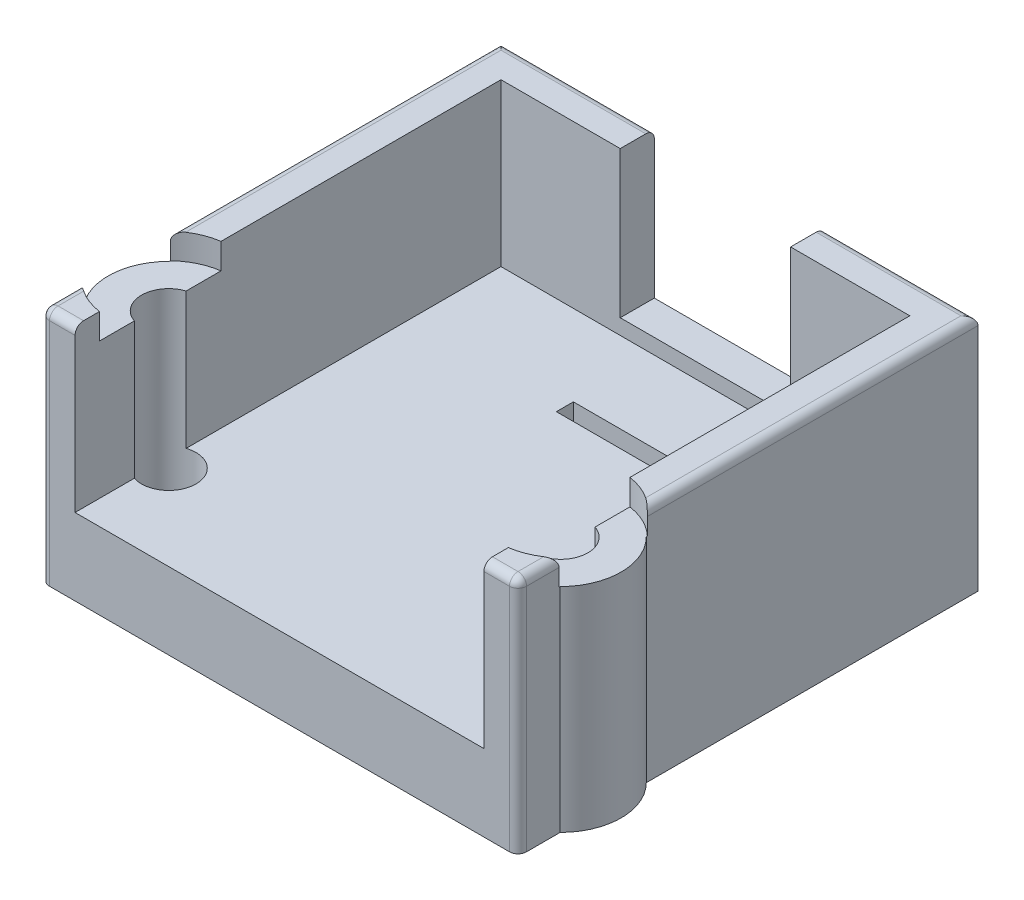
from build123d import *

# Parameters (mm, degrees)
SKETCH1_W           = 28
SKETCH1_H           = 27
BOSS_EXTRUDE1_DEPTH = 14
SHELL1_T            = -2
SKETCH2_W           = 24
SKETCH2_H           = 23
SKETCH2_W_2         = 6
SKETCH2_H_2         = 1
BOSS_EXTRUDE2_DEPTH = 2.5
CUT_EXTRUDE1_REACH  = 35.481
SKETCH3_W           = 24
SKETCH3_H           = 9.5
CUT_EXTRUDE2_REACH  = 25.964
SKETCH4_R           = 1.6
BOSS_EXTRUDE3_DEPTH = 14
CUT_EXTRUDE4_REACH  = 34.368
SKETCH7_W           = 10
SKETCH7_H           = 8.6
SKETCH8_R           = 3.6
CUT_EXTRUDE5_DEPTH  = 1.5
FILLET1_R           = 0.5


with BuildPart() as part:
    # Sketch1 → Boss-Extrude1 (new body)
    with BuildSketch(Plane(origin=(0, 0, 0), x_dir=(1, 0, 0), z_dir=(0, 1, 0))):
        Rectangle(SKETCH1_W, SKETCH1_H)
    extrude(amount=BOSS_EXTRUDE1_DEPTH)

    # Shell1
    shell1_openings = [part.faces().sort_by_distance(p)[0] for p in [
        (0, 14, 0),
    ]]
    offset(amount=SHELL1_T, openings=shell1_openings, kind=Kind.INTERSECTION)

    # Sketch2 → Boss-Extrude2 (add)
    with BuildSketch(Plane(origin=(0, 2, 0), x_dir=(1, 0, 0), z_dir=(0, 1, 0))):
        Rectangle(SKETCH2_W, SKETCH2_H)
        with Locations((0, 6.25)):
            Rectangle(SKETCH2_W_2, SKETCH2_H_2, mode=Mode.SUBTRACT)
    extrude(amount=BOSS_EXTRUDE2_DEPTH)

    # Sketch3 → Cut-Extrude1 (cut, up to next)
    with BuildSketch(Plane.XY.offset(13.5), mode=Mode.PRIVATE) as cut_extrude1_sk1:
        with Locations((0, 9.25)):
            Rectangle(SKETCH3_W, SKETCH3_H)
    cut_extrude1_tool1 = extrude(cut_extrude1_sk1.sketch, amount=-CUT_EXTRUDE1_REACH, mode=Mode.PRIVATE) & part.part
    add(cut_extrude1_tool1.solids().sort_by_distance((0, 9.25, 13.5))[0], mode=Mode.SUBTRACT)

    # Sketch4 → Cut-Extrude2 (cut, up to next)
    with BuildSketch(Plane(origin=(0, 14, 0), x_dir=(1, 0, 0), z_dir=(0, 1, 0)), mode=Mode.PRIVATE) as cut_extrude2_sk1:
        with Locations(Location((-11.5, -8.5, 0), (0, 0, 251.790043136))):
            Circle(SKETCH4_R)
    cut_extrude2_tool1 = extrude(cut_extrude2_sk1.sketch, amount=-CUT_EXTRUDE2_REACH, mode=Mode.PRIVATE) & part.part
    # Sketch4 → Cut-Extrude2 (cut, up to next)
    with BuildSketch(Plane(origin=(0, 14, 0), x_dir=(1, 0, 0), z_dir=(0, 1, 0)), mode=Mode.PRIVATE) as cut_extrude2_sk2:
        with Locations(Location((11.5, -8.5, 0), (0, 0, 288.209956864))):
            Circle(SKETCH4_R)
    cut_extrude2_tool2 = extrude(cut_extrude2_sk2.sketch, amount=-CUT_EXTRUDE2_REACH, mode=Mode.PRIVATE) & part.part
    add(cut_extrude2_tool1.solids().sort_by_distance((-11.5, 14, 8.5))[0], mode=Mode.SUBTRACT)
    add(cut_extrude2_tool2.solids().sort_by_distance((11.5, 14, 8.5))[0], mode=Mode.SUBTRACT)

    # Sketch5 → Boss-Extrude3 (add)
    with BuildSketch(Plane(origin=(0, 14, 0), x_dir=(1, 0, 0), z_dir=(0, 1, 0))):
        with BuildLine():
            Line((12, -4.980131585), (12, -6.980131585))
            ThreePointArc((12, -6.980131585), (13.1, -8.5), (12, -10.019868415))
            Line((12, -10.019868415), (12, -12.019868415))
            ThreePointArc((12, -12.019868415), (15.055203744, -8.5), (12, -4.980131585))
        make_face()
        with BuildLine():
            Line((-12, -4.980131585), (-12, -6.980131585))
            ThreePointArc((-12, -6.980131585), (-13.1, -8.5), (-12, -10.019868415))
            Line((-12, -10.019868415), (-12, -12.019868415))
            ThreePointArc((-12, -12.019868415), (-15.055203744, -8.5), (-12, -4.980131585))
        make_face()
    extrude(amount=-BOSS_EXTRUDE3_DEPTH)

    # Sketch7 → Cut-Extrude4 (cut, up to next)
    with BuildSketch(Plane.XY.offset(-11.5), mode=Mode.PRIVATE) as cut_extrude4_sk1:
        with Locations((0, 9.7)):
            Rectangle(SKETCH7_W, SKETCH7_H)
    cut_extrude4_tool1 = extrude(cut_extrude4_sk1.sketch, amount=-CUT_EXTRUDE4_REACH, mode=Mode.PRIVATE) & part.part
    add(cut_extrude4_tool1.solids().sort_by_distance((0, 9.7, -11.5))[0], mode=Mode.SUBTRACT)

    # Sketch8 → Cut-Extrude5 (cut)
    with BuildSketch(Plane(origin=(0, 14, 0), x_dir=(1, 0, 0), z_dir=(0, 1, 0))):
        with Locations((11.5, -8.5)):
            Circle(SKETCH8_R)
        with Locations((-11.5, -8.5)):
            Circle(SKETCH8_R)
    extrude(amount=-CUT_EXTRUDE5_DEPTH, mode=Mode.SUBTRACT)

    # Fillet1
    fillet1_edges = [part.edges().sort_by_distance(p)[0] for p in [
        (14, 14, 12.295183385),
        (9.5, 14, -13.5),
        (-13, 14, 13.5),
        (-14, 14, -3.795183385),
        (14, 14, -3.795183385),
        (-14, 14, 12.295183385),
        (13, 14, 13.5),
        (-14, 7, 13.5),
        (14, 7, 13.5),
        (-9.5, 14, -13.5),
    ]]
    fillet(fillet1_edges, radius=FILLET1_R)


solid = part.part
